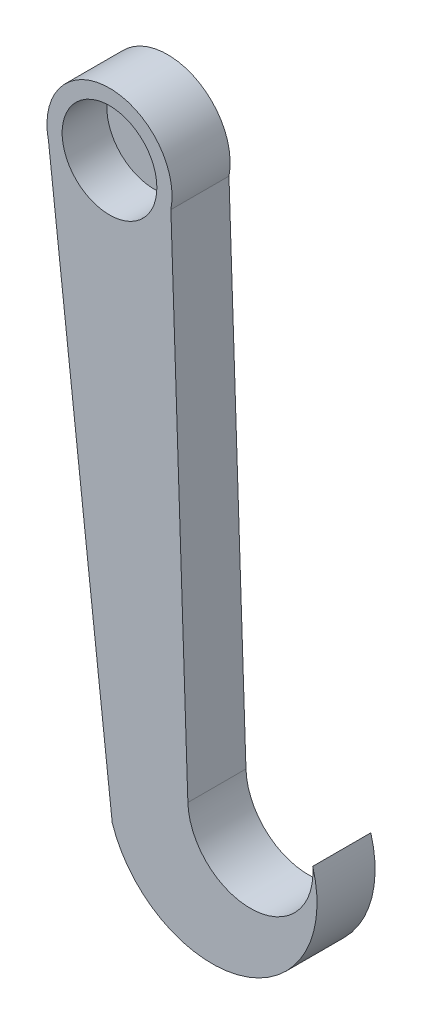
from build123d import *

# Parameters (mm, degrees)
SKETCH_1_R          = 14
EXTRUDE_1_DEPTH     = 13
SKETCH_3_R          = 4
CUT_EXTRUDE_2_DEPTH = 10
EXTRUDE_START       = -13
EXTRUDE_3_DEPTH     = 13
SKETCH_7_R          = 10.6
CUT_EXTRUDE_3_DEPTH = 10


with BuildPart() as part:
    # 스케치1 → 보스-돌출1 (new body)
    with BuildSketch(Plane.XY):
        with Locations(Location((0, 0, 0), (0, 0, 180))):
            Circle(SKETCH_1_R)
    extrude(amount=EXTRUDE_1_DEPTH)

    # 스케치3 → 컷-돌출2 (cut)
    with BuildSketch(Plane.XY.offset(13)):
        Circle(SKETCH_3_R)
    extrude(amount=-CUT_EXTRUDE_2_DEPTH, mode=Mode.SUBTRACT)

    # 스케치6 → 보스-돌출3 (add)
    with BuildSketch(Plane.XY.offset(13).offset(EXTRUDE_START)):
        with BuildLine():
            Line((13.735578357, -2.708115061), (17.539668143, -115.708115061))
            ThreePointArc((17.539668143, -115.708115061), (32.332669837, -129.214149758), (45.486033392, -114.10670459))
            ThreePointArc((45.486033392, -114.10670459), (29.938586036, -143.187708961), (0.608578272, -128.115264599))
            Line((0.608578272, -128.115264599), (-13.64899727, -3.115264599))
            ThreePointArc((-13.64899727, -3.115264599), (0.208126783, -13.998452887), (13.735578357, -2.708115061))
        make_face()
    extrude(amount=EXTRUDE_3_DEPTH)

    # 스케치7 → 컷-돌출3 (cut)
    with BuildSketch(Plane.XY.offset(13)):
        Circle(SKETCH_7_R)
    extrude(amount=-CUT_EXTRUDE_3_DEPTH, mode=Mode.SUBTRACT)


solid = part.part
